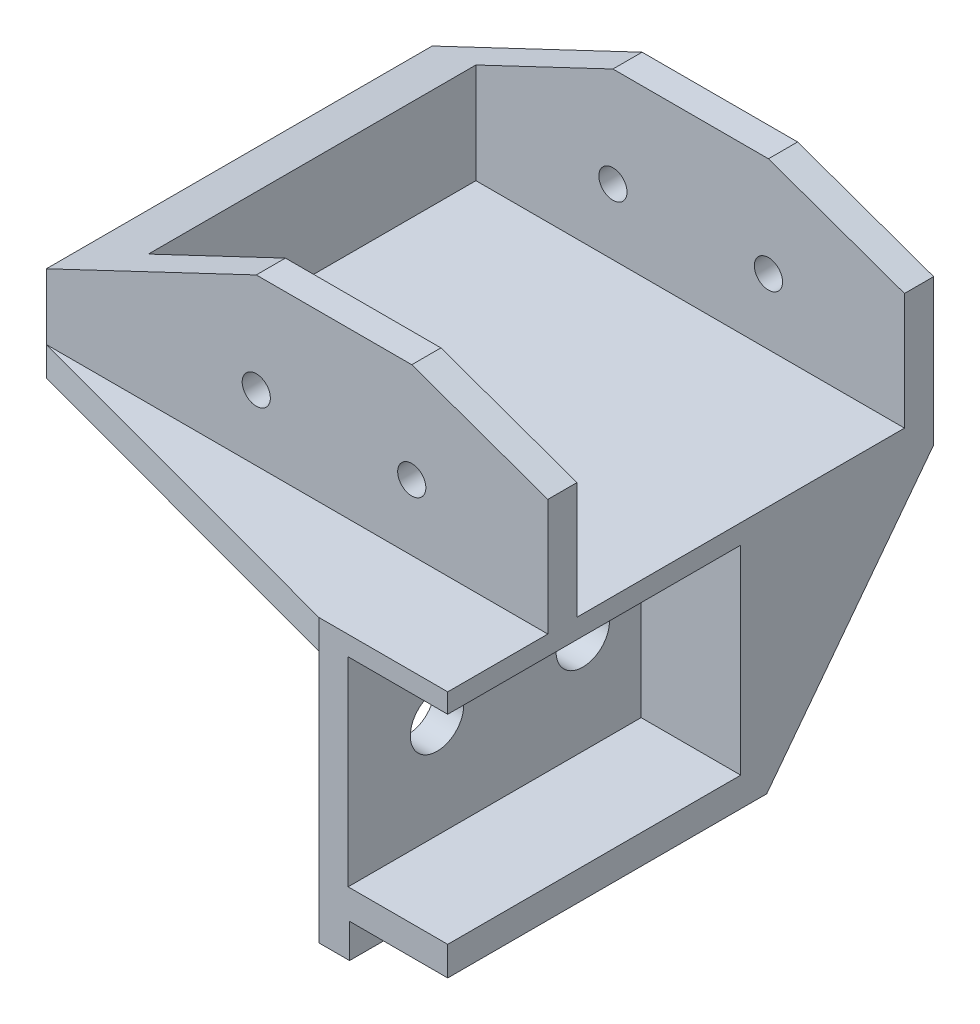
from build123d import *

# Parameters (mm, degrees)
SKETCH_1_W                     = 103.2
SKETCH_1_H                     = 20
EXTRUDE_1_DEPTH                = 39.7
SKETCH_2_W                     = 88.2
SKETCH_2_H                     = 33.7
CUT_EXTRUDE_1_DEPTH            = 17
EXTRUDE_START                  = -3
SKETCH_3_W                     = 26.5
SKETCH_3_H                     = 50
EXTRUDE_2_DEPTH                = 29
SKETCH_21_W                    = 20.5
SKETCH_21_H                    = 20.5
CUT_EXTRUDE_11_DEPTH           = 30.15
SKETCH_22_W                    = 20.2
SKETCH_22_H                    = 50
CUT_EXTRUDE_12_DEPTH           = 3.5
CUT_EXTRUDE_14_DEPTH           = 86.915787257
EXTRUDE_4_DEPTH                = 3
HOLE_WIZARD_M2_5_1_D           = 2.9
HOLE_WIZARD_M2_5_1_CSINK_D     = 2.95
HOLE_WIZARD_M2_5_1_CSINK_ANGLE = 90
HOLE_WIZARD_M5_2_D             = 5.5
HOLE_WIZARD_M5_2_CSINK_D       = 5.55
HOLE_WIZARD_M5_2_CSINK_ANGLE   = 90
CUT_EXTRUDE_19_DEPTH           = 118.585033061
SKETCH_36_W                    = 50
SKETCH_36_H                    = 46
CUT_EXTRUDE_20_DEPTH           = 51.6


with BuildPart() as part:
    # 草图1 → 凸台-拉伸1 (new body)
    with BuildSketch(Plane.XY):
        with Locations((-51.6, 10)):
            Rectangle(SKETCH_1_W, SKETCH_1_H)
    extrude(amount=EXTRUDE_1_DEPTH)

    # 草图2 → 切除-拉伸1 (cut)
    with BuildSketch(Plane(origin=(0, 20, 0), x_dir=(1, 0, 0), z_dir=(0, 1, 0))):
        with Locations((-51.6, -19.85)):
            Rectangle(SKETCH_2_W, SKETCH_2_H)
    extrude(amount=-CUT_EXTRUDE_1_DEPTH, mode=Mode.SUBTRACT)

    # 草图3 → 凸台-拉伸2 (add)
    with BuildSketch(Plane.XZ.offset(EXTRUDE_START)):
        with Locations((-51.6, 25)):
            Rectangle(SKETCH_3_W, SKETCH_3_H)
    extrude(amount=EXTRUDE_2_DEPTH)

    # 草图21 → 切除-拉伸11 (cut)
    with BuildSketch(Plane.XY.offset(50)):
        with Locations((-51.6, -9.25)):
            Rectangle(SKETCH_21_W, SKETCH_21_H)
    extrude(amount=-CUT_EXTRUDE_11_DEPTH, mode=Mode.SUBTRACT)

    # 草图22 → 切除-拉伸12 (cut)
    with BuildSketch(Plane.XZ.offset(26)):
        with Locations((-51.6, 25)):
            Rectangle(SKETCH_22_W, SKETCH_22_H)
    extrude(amount=-CUT_EXTRUDE_12_DEPTH, mode=Mode.SUBTRACT)

    # 草图24 → 切除-拉伸14 (cut, through all)
    with BuildSketch(Plane(origin=(-38.35, 0, 0), x_dir=(0, 0, -1), z_dir=(1, 0, 0))):
        Polygon((0, 0), (0, -26), (-19.85, -26), align=None)
    extrude(amount=-CUT_EXTRUDE_14_DEPTH, mode=Mode.SUBTRACT)

    # 草图25 → 凸台-拉伸4 (add)
    with BuildSketch(Plane.XZ):
        Polygon((-38.35, 39.7), (-38.35, 50), (0, 39.7), align=None)
        Polygon((-64.85, 39.7), (-103.2, 39.7), (-64.85, 50), align=None)
    extrude(amount=-EXTRUDE_4_DEPTH)

    # M2.5 间隙孔1 (through all)
    with Locations(Plane(origin=(0, 0, 0), x_dir=(-1, 0, 0), z_dir=(0, 0, -1))):
        with Locations((81.6, 9.75), (37.6, 9.75), (21.6, 9.75), (65.6, 9.75)):
            CounterSinkHole(HOLE_WIZARD_M2_5_1_D / 2, HOLE_WIZARD_M2_5_1_CSINK_D / 2, counter_sink_angle=HOLE_WIZARD_M2_5_1_CSINK_ANGLE)

    # M5 间隙孔2 (through all)
    with Locations(Plane(origin=(-38.35, 0, 0), x_dir=(0, 0, -1), z_dir=(1, 0, 0))):
        with Locations((-40.85, -9.25), (-25.85, -9.25)):
            CounterSinkHole(HOLE_WIZARD_M5_2_D / 2, HOLE_WIZARD_M5_2_CSINK_D / 2, counter_sink_angle=HOLE_WIZARD_M5_2_CSINK_ANGLE)

    # 草图35 → 切除-拉伸19 (cut, through all)
    with BuildSketch(Plane(origin=(0, 0, 0), x_dir=(-1, 0, 0), z_dir=(0, 0, -1))):
        Polygon((103.2, 20), (81.6, 20), (103.2, 9.75), align=None)
        Polygon((0, 20), (0, 9.75), (21.6, 20), align=None)
        Polygon((65.6, 20), (51.6, 15), (37.6, 20), align=None)
    extrude(amount=-CUT_EXTRUDE_19_DEPTH, mode=Mode.SUBTRACT)

    # 草图36 → 切除-拉伸20 (cut)
    with BuildSketch(Plane.ZY.offset(51.6)):
        with Locations((25, -3)):
            Rectangle(SKETCH_36_W, SKETCH_36_H)
    extrude(amount=-CUT_EXTRUDE_20_DEPTH, mode=Mode.SUBTRACT)


solid = part.part
